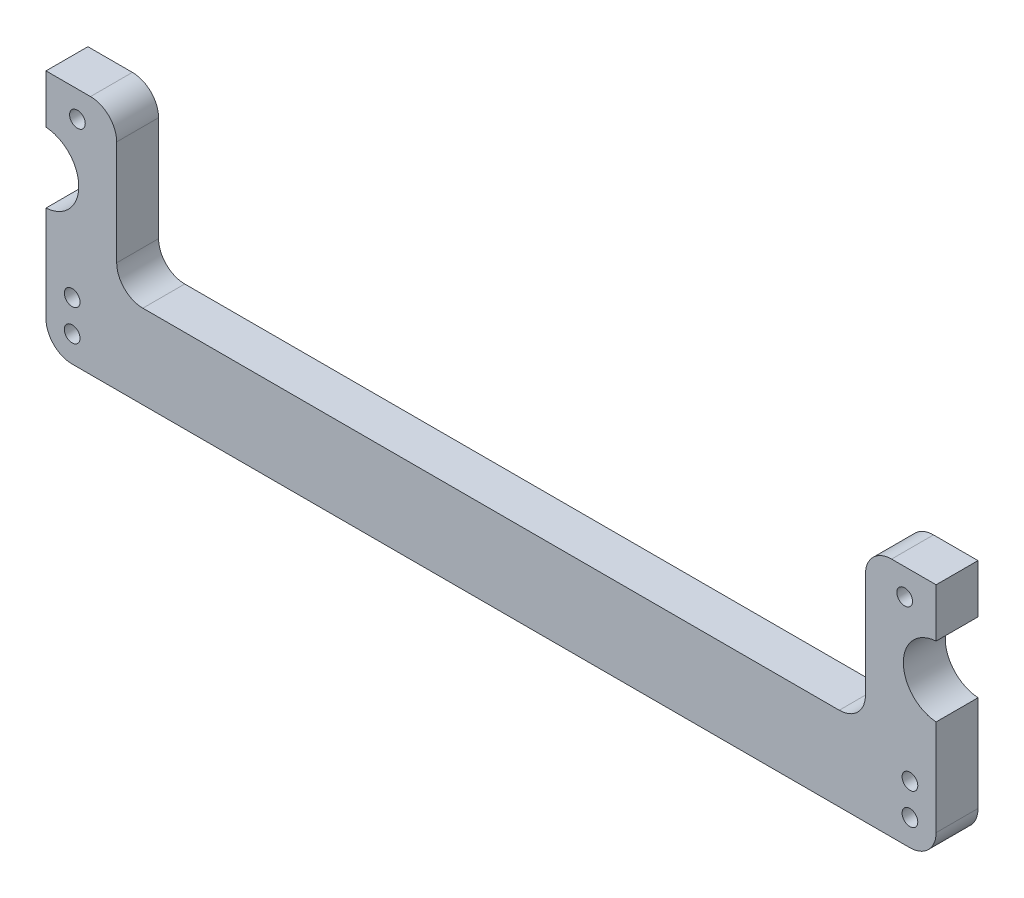
from build123d import *

# Parameters (mm, degrees)
SKETCH_1_R          = 1.5
EXTRUDE_1_DEPTH     = 8
CUT_EXTRUDE_1_DEPTH = 177.295206968


with BuildPart() as part:
    # 草图1 → 凸台-拉伸1 (new body)
    with BuildSketch(Plane.XY):
        with BuildLine():
            Line((5, 0), (165, 0))
            ThreePointArc((165, 0), (168.535533906, 1.464466094), (170, 5))
            Line((170, 5), (170, 11))
            Line((170, 11), (170, 16))
            Line((170, 16), (170, 46))
            Line((170, 46), (161.5, 46))
            ThreePointArc((161.5, 46), (157.964466094, 44.535533906), (156.5, 41))
            Line((156.5, 41), (156.5, 21))
            ThreePointArc((156.5, 21), (155.035533906, 17.464466094), (151.5, 16))
            Line((151.5, 16), (18.5, 16))
            ThreePointArc((18.5, 16), (14.964466094, 17.464466094), (13.5, 21))
            Line((13.5, 21), (13.5, 41))
            ThreePointArc((13.5, 41), (12.035533906, 44.535533906), (8.5, 46))
            Line((8.5, 46), (0, 46))
            Line((0, 46), (0, 16))
            Line((0, 16), (0, 11))
            Line((0, 11), (0, 5))
            ThreePointArc((0, 5), (1.464466094, 1.464466094), (5, 0))
        make_face()
        with Locations((5, 11)):
            Circle(SKETCH_1_R, mode=Mode.SUBTRACT)
        with Locations(Location((5, 5, 0), (0, 0, 180))):
            Circle(SKETCH_1_R, mode=Mode.SUBTRACT)
        with Locations((165, 5)):
            Circle(SKETCH_1_R, mode=Mode.SUBTRACT)
        with Locations(Location((165, 11, 0), (0, 0, 180))):
            Circle(SKETCH_1_R, mode=Mode.SUBTRACT)
        with Locations((6, 41)):
            Circle(SKETCH_1_R, mode=Mode.SUBTRACT)
        with Locations(Location((164, 41, 0), (0, 0, 180))):
            Circle(SKETCH_1_R, mode=Mode.SUBTRACT)
    extrude(amount=EXTRUDE_1_DEPTH)

    # 草图2 → 切除-拉伸1 (cut, through all)
    with BuildSketch(Plane.XY.offset(8)):
        with BuildLine():
            Line((-0.44, 36.7), (-0.44, 23.3))
            ThreePointArc((-0.44, 23.3), (6.26, 30), (-0.44, 36.7))
        make_face()
        with BuildLine():
            Line((170.44, 36.7), (170.44, 23.3))
            ThreePointArc((170.44, 23.3), (163.74, 30), (170.44, 36.7))
        make_face()
    extrude(amount=-CUT_EXTRUDE_1_DEPTH, mode=Mode.SUBTRACT)


solid = part.part
